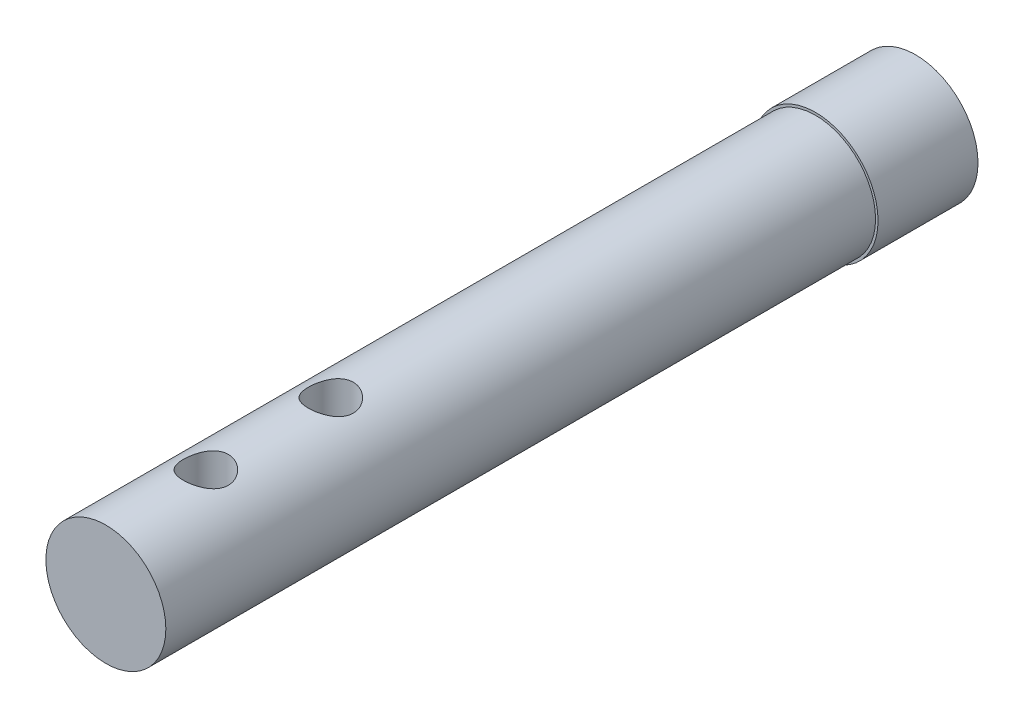
from build123d import *

# Parameters (mm, degrees)
SKETCH1_R               = 10
BOSS_EXTRUDE1_DEPTH     = 15
SKETCH2_R               = 12.5
BOSS_EXTRUDE2_DEPTH     = 20
SKETCH3_R               = 12
BOSS_EXTRUDE3_DEPTH     = 142
SKETCH4_R               = 4.5
CUT_EXTRUDE1_DEPTH      = 178.880577917
CUT_EXTRUDE2_DEPTH      = 178.880578016
CUT_EXTRUDE2_DEPTH_BACK = 178.880578016
SKETCH5_W               = 50.129657838
SKETCH5_H               = 19.874218845
LPATTERN1_COUNT         = 2
LPATTERN1_PITCH         = 25


with BuildPart() as part:
    # Sketch1 → Boss-Extrude1 (new body)
    with BuildSketch(Plane.XY):
        Circle(SKETCH1_R)
    extrude(amount=BOSS_EXTRUDE1_DEPTH)

    # Sketch2 → Boss-Extrude2 (add)
    with BuildSketch(Plane.XY.offset(15)):
        Circle(SKETCH2_R)
    extrude(amount=BOSS_EXTRUDE2_DEPTH)

    # Sketch3 → Boss-Extrude3 (add)
    with BuildSketch(Plane.XY.offset(35)):
        Circle(SKETCH3_R)
    extrude(amount=BOSS_EXTRUDE3_DEPTH)

    # Sketch4 → Cut-Extrude1 (cut, symmetric)
    with BuildSketch(Plane(origin=(0, 0, 0), x_dir=(1, 0, 0), z_dir=(0, 1, 0))):
        with Locations(Location((0, -157, 0), (0, 0, 270))):
            Circle(SKETCH4_R)
    cut_extrude1 = extrude(amount=CUT_EXTRUDE1_DEPTH, both=True, mode=Mode.SUBTRACT)

    # Sketch5 → Cut-Extrude2 (cut, two sides: drawn at the far end of the back side and taken through both)
    with BuildSketch(Plane(origin=(0, 0, 0), x_dir=(1, 0, 0), z_dir=(0, 1, 0)).offset(-CUT_EXTRUDE2_DEPTH_BACK)):
        with Locations((-12.564828919, -5.062890578)):
            Rectangle(SKETCH5_W, SKETCH5_H)
    extrude(amount=CUT_EXTRUDE2_DEPTH + CUT_EXTRUDE2_DEPTH_BACK, mode=Mode.SUBTRACT)

    # LPattern1: Cut-Extrude1 ×2
    with Locations(*[(0, 0, -i * LPATTERN1_PITCH) for i in range(1, LPATTERN1_COUNT)]):
        add(cut_extrude1, mode=Mode.SUBTRACT)


solid = part.part
